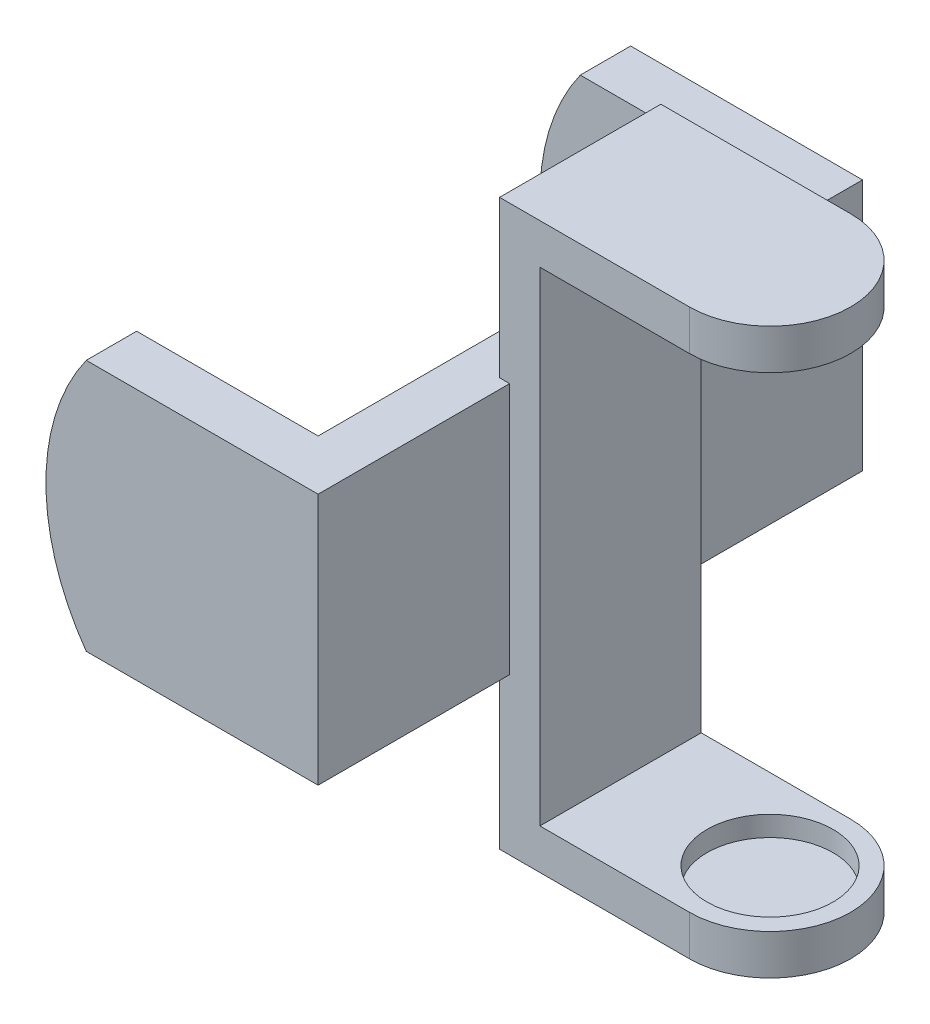
from build123d import *

# Parameters (mm, degrees)
BOSS_EXTRUDE1_DEPTH      = 56
SHELL1_T                 = -4
CUT_EXTRUDE1_START       = -4
SKETCH2_R                = 6.25
CUT_EXTRUDE1_DEPTH       = 2
CUT_EXTRUDE2_START       = -54
SKETCH2_2_R              = 6.25
CUT_EXTRUDE2_DEPTH       = 2
BOSS_EXTRUDE2_DEPTH      = 4
BOSS_EXTRUDE2_DEPTH_BACK = 1
SKETCH3_W                = 54
SKETCH3_H                = 25
BOSS_EXTRUDE3_DEPTH      = 5
BOSS_EXTRUDE4_START      = -49
BOSS_EXTRUDE4_DEPTH      = 5


with BuildPart() as part:
    # Sketch1 → Boss-Extrude1 (new body)
    with BuildSketch(Plane(origin=(0, 0, 0), x_dir=(1, 0, 0), z_dir=(0, 1, 0))):
        with BuildLine():
            Line((0, 0), (0, 16))
            Line((0, 16), (18.828724193, 16))
            ThreePointArc((18.828724193, 16), (26.828724193, 8), (18.828724193, 0))
            Line((18.828724193, 0), (0, 0))
        make_face()
    extrude(amount=BOSS_EXTRUDE1_DEPTH)

    # Shell1
    shell1_openings = [part.faces().sort_by_distance(p)[0] for p in [
        (9.414362096, 28, 0),
        (9.414362096, 28, -16),
        (26.828724193, 28, -8),
    ]]
    offset(amount=SHELL1_T, openings=shell1_openings, kind=Kind.INTERSECTION)

    # Sketch2 → Cut-Extrude1 (cut)
    with BuildSketch(Plane.XZ.offset(CUT_EXTRUDE1_START)):
        with Locations(Location((18.828724193, -8, 0), (0, 0, 90))):
            Circle(SKETCH2_R)
    extrude(amount=CUT_EXTRUDE1_DEPTH, mode=Mode.SUBTRACT)

    # Sketch2<2> → Cut-Extrude2 (cut)
    with BuildSketch(Plane.XZ.offset(CUT_EXTRUDE2_START)):
        with Locations(Location((18.828724193, -8, 0), (0, 0, 90))):
            Circle(SKETCH2_2_R)
    extrude(amount=CUT_EXTRUDE2_DEPTH, mode=Mode.SUBTRACT)

    # Sketch3 → Boss-Extrude2 (add, two sides: drawn at the far end of the back side and taken through both)
    with BuildSketch(Plane.ZY.offset(-BOSS_EXTRUDE2_DEPTH_BACK)):
        with Locations((-8, 28)):
            Rectangle(SKETCH3_W, SKETCH3_H)
    extrude(amount=BOSS_EXTRUDE2_DEPTH + BOSS_EXTRUDE2_DEPTH_BACK)

    # Sketch4 → Boss-Extrude3 (add)
    with BuildSketch(Plane.XY.offset(19)):
        with BuildLine():
            Line((-4, 15.5), (-4, 40.5))
            Line((-4, 40.5), (-22, 40.5))
            ThreePointArc((-22, 40.5), (-26, 28), (-22, 15.5))
            Line((-22, 15.5), (-4, 15.5))
        make_face()
    extrude(amount=-BOSS_EXTRUDE3_DEPTH)

    # Sketch4<4> → Boss-Extrude4 (add)
    with BuildSketch(Plane.XY.offset(19).offset(BOSS_EXTRUDE4_START)):
        with BuildLine():
            Line((-4, 15.5), (-4, 40.5))
            Line((-4, 40.5), (-22, 40.5))
            ThreePointArc((-22, 40.5), (-26, 28), (-22, 15.5))
            Line((-22, 15.5), (-4, 15.5))
        make_face()
    extrude(amount=-BOSS_EXTRUDE4_DEPTH)


solid = part.part
